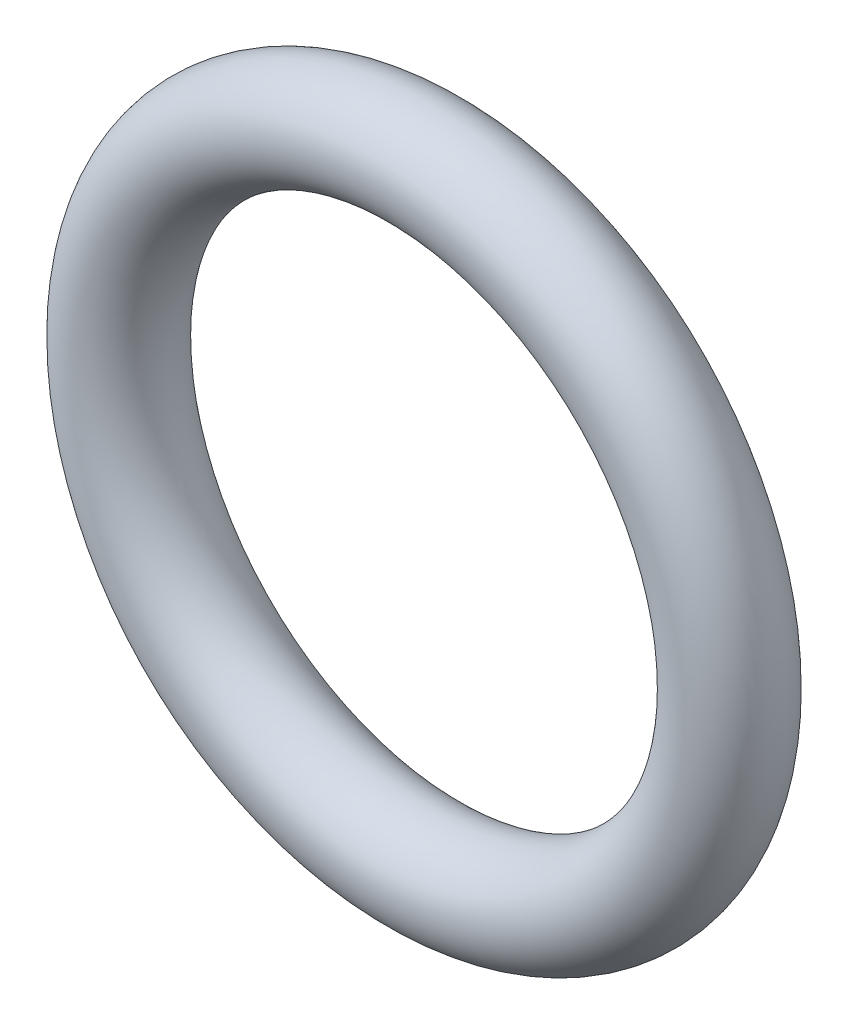
from build123d import *

# Parameters (mm, degrees)
WYCI_GNI_CIE_PO_CIE_CE1_PROFILE_R = 1


with BuildPart() as part:
    # Wyciągnięcie po ścieżce1: sweep along a path in Szkic1
    with BuildLine(Plane.XY) as wyci_gni_cie_po_cie_ce1_path:
        CenterArc((0, 0), 6, 0, 360)
    # Wyciągnięcie po ścieżce1 profile (on start of the path) → Wyciągnięcie po ścieżce1 (sweep)
    with BuildSketch(Plane(origin=(6, 0, 0), x_dir=(0, 0, 1), z_dir=(0, 1, 0))):
        Circle(WYCI_GNI_CIE_PO_CIE_CE1_PROFILE_R)
    sweep(path=wyci_gni_cie_po_cie_ce1_path.line)


solid = part.part
